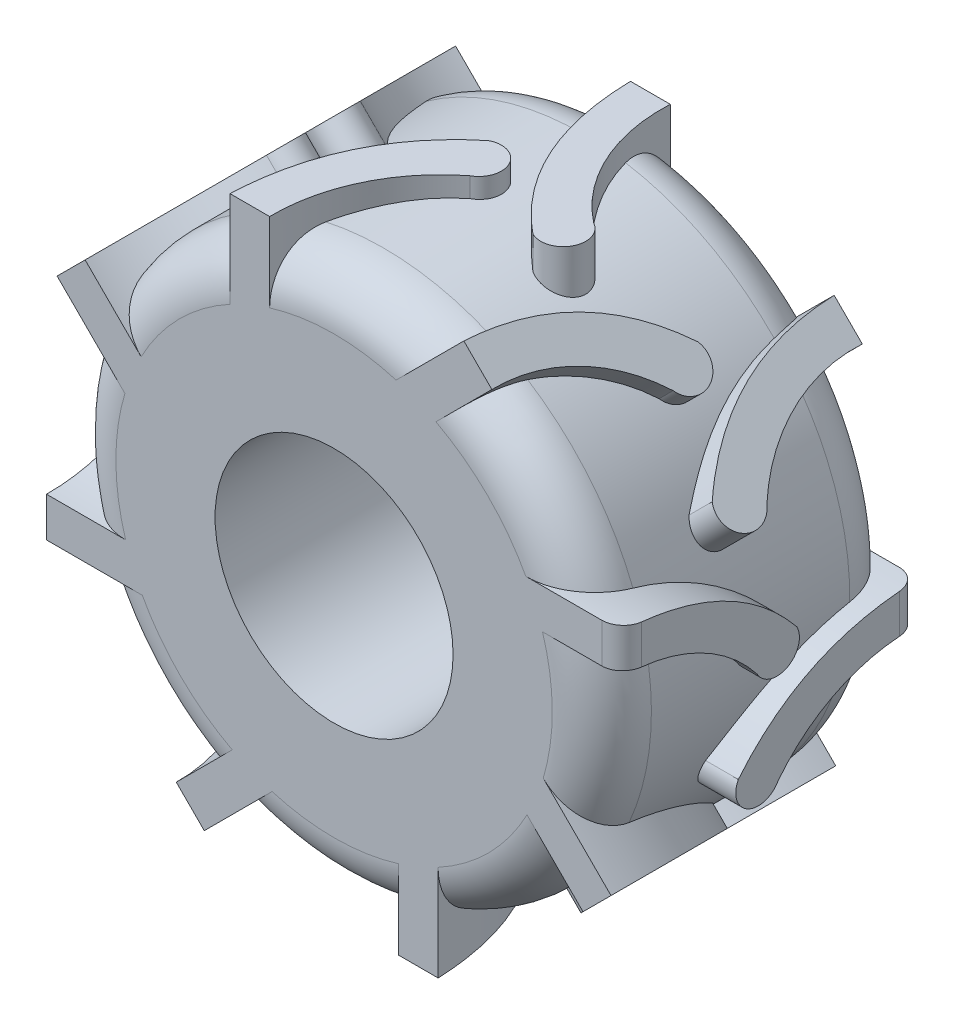
from build123d import *

# Parameters (mm, degrees)
SKETCH1_R           = 27
SKETCH1_R_2         = 12
BOSS_EXTRUDE1_DEPTH = 30
FILLET1_R           = 5
BOSS_EXTRUDE2_REACH = 71.029
FILLET2_R           = 2
CIRPATTERN2_COUNT   = 8


with BuildPart() as part:
    # Sketch1 → Boss-Extrude1 (new body)
    with BuildSketch(Plane.XY):
        Circle(SKETCH1_R)
        Circle(SKETCH1_R_2, mode=Mode.SUBTRACT)
    extrude(amount=BOSS_EXTRUDE1_DEPTH)

    # Fillet1
    fillet1_edges = [part.edges().sort_by_distance(p)[0] for p in [
        (-27, 0, 0),
        (-27, 0, 30),
    ]]
    fillet(fillet1_edges, radius=FILLET1_R)

    # Sketch2 → Boss-Extrude2 (add, up to next)
    with BuildSketch(Plane(origin=(29, 0, 0), x_dir=(0, 0, -1), z_dir=(1, 0, 0)), mode=Mode.PRIVATE) as boss_extrude2_sk1:
        with BuildLine():
            Line((-30, 10.493268325), (-30, 6.496859821))
            ThreePointArc((-30, 6.496859821), (-22.398648889, 4.83738388), (-16.337559813, -0.040894332))
            ThreePointArc((-16.337559813, -0.040894332), (-13.278105659, -0.956145577), (-12.337559813, 2.095627361))
            add(Edge.make_bspline(
                [(-12.337559813, 2.095627361), (-18.84369006, 10.039356679), (-30, 10.493268325)],
                knots=[0, 0, 0, 1, 1, 1], degree=2))
        make_face()
    boss_extrude2_tool1 = extrude(boss_extrude2_sk1.sketch, amount=-BOSS_EXTRUDE2_REACH, mode=Mode.PRIVATE) - part.part
    # Sketch2 → Boss-Extrude2 (add, up to next)
    with BuildSketch(Plane(origin=(29, 0, 0), x_dir=(0, 0, -1), z_dir=(1, 0, 0)), mode=Mode.PRIVATE) as boss_extrude2_sk2:
        with BuildLine():
            Line((0, 0.110580332), (0, -3.901484292))
            ThreePointArc((0, -3.901484292), (-7.915663223, -5.421663233), (-14.236222824, -10.423582325))
            ThreePointArc((-14.236222824, -10.423582325), (-17.295676978, -11.33883357), (-18.236222824, -8.287060631))
            add(Edge.make_bspline(
                [(-18.236222824, -8.287060631), (-11.546444561, -0.123570776), (0, 0.110580332)],
                knots=[0, 0, 0, 1, 1, 1], degree=2))
        make_face()
    boss_extrude2_tool2 = extrude(boss_extrude2_sk2.sketch, amount=-BOSS_EXTRUDE2_REACH, mode=Mode.PRIVATE) - part.part
    boss_extrude2_1 = boss_extrude2_tool1.solids().sort_by_distance((29, 5.356339, 20.640873))[0]
    add(boss_extrude2_1)
    boss_extrude2_2 = boss_extrude2_tool2.solids().sort_by_distance((29, -4.943998, 9.674541))[0]
    add(boss_extrude2_2)
    boss_extrude2 = boss_extrude2_1 + boss_extrude2_2  # Boss-Extrude2 as one shape, for the pattern or mirror that repeats it

    # Fillet2
    fillet2_edges = [part.edges().sort_by_distance(p)[0] for p in [
        (29, -1.89545198, 0),
        (29, 8.495064073, 30),
    ]]
    fillet(fillet2_edges, radius=FILLET2_R)

    # CirPattern2: Boss-Extrude2 ×8 about axis
    cirpattern2_axis = Axis((0, 0, 30), (0, 0, -1))
    for i in range(1, CIRPATTERN2_COUNT):
        add(boss_extrude2.rotate(cirpattern2_axis, i * 360 / CIRPATTERN2_COUNT))


solid = part.part
